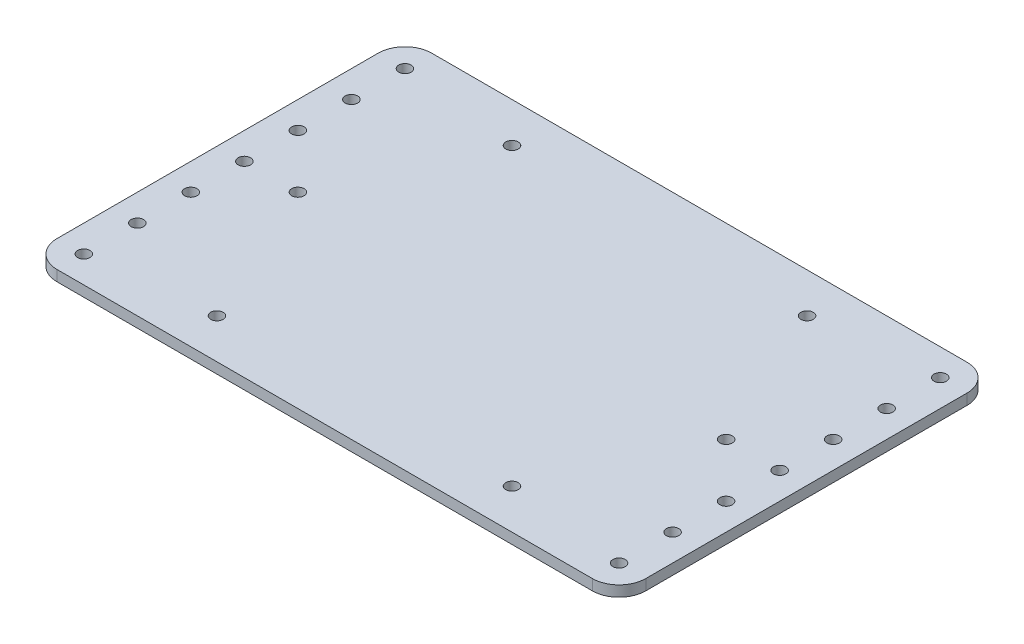
from build123d import *

# Parameters (mm, degrees)
SKETCH1_W           = 139.7
SKETCH1_H           = 88.9
SKETCH1_R           = 1.4732
BOSS_EXTRUDE1_DEPTH = 2.54
FILLET1_R           = 6.35


with BuildPart() as part:
    # Sketch1 → Boss-Extrude1 (new body)
    with BuildSketch(Plane(origin=(0, 0, 0), x_dir=(1, 0, 0), z_dir=(0, 1, 0))):
        with Locations((69.85, -44.45)):
            Rectangle(SKETCH1_W, SKETCH1_H)
        with Locations(Location((34.85, -9.45, 0), (0, 0, 270))):
            Circle(SKETCH1_R, mode=Mode.SUBTRACT)
        with Locations(Location((6.35, -6.35, 0), (0, 0, 270))):
            Circle(SKETCH1_R, mode=Mode.SUBTRACT)
        with Locations(Location((6.35, -19.05, 0), (0, 0, 270))):
            Circle(SKETCH1_R, mode=Mode.SUBTRACT)
        with Locations(Location((6.35, -31.75, 0), (0, 0, 270))):
            Circle(SKETCH1_R, mode=Mode.SUBTRACT)
        with Locations(Location((6.35, -44.45, 0), (0, 0, 270))):
            Circle(SKETCH1_R, mode=Mode.SUBTRACT)
        with Locations(Location((6.35, -57.15, 0), (0, 0, 270))):
            Circle(SKETCH1_R, mode=Mode.SUBTRACT)
        with Locations(Location((6.35, -69.85, 0), (0, 0, 270))):
            Circle(SKETCH1_R, mode=Mode.SUBTRACT)
        with Locations(Location((6.35, -82.55, 0), (0, 0, 270))):
            Circle(SKETCH1_R, mode=Mode.SUBTRACT)
        with Locations(Location((104.85, -9.45, 0), (0, 0, 270))):
            Circle(SKETCH1_R, mode=Mode.SUBTRACT)
        with Locations(Location((104.85, -79.45, 0), (0, 0, 270))):
            Circle(SKETCH1_R, mode=Mode.SUBTRACT)
        with Locations(Location((34.85, -79.45, 0), (0, 0, 270))):
            Circle(SKETCH1_R, mode=Mode.SUBTRACT)
        with Locations(Location((133.35, -82.55, 0), (0, 0, 90))):
            Circle(SKETCH1_R, mode=Mode.SUBTRACT)
        with Locations(Location((133.35, -69.85, 0), (0, 0, 90))):
            Circle(SKETCH1_R, mode=Mode.SUBTRACT)
        with Locations(Location((133.35, -57.15, 0), (0, 0, 90))):
            Circle(SKETCH1_R, mode=Mode.SUBTRACT)
        with Locations(Location((133.35, -44.45, 0), (0, 0, 90))):
            Circle(SKETCH1_R, mode=Mode.SUBTRACT)
        with Locations(Location((133.35, -31.75, 0), (0, 0, 90))):
            Circle(SKETCH1_R, mode=Mode.SUBTRACT)
        with Locations(Location((133.35, -19.05, 0), (0, 0, 90))):
            Circle(SKETCH1_R, mode=Mode.SUBTRACT)
        with Locations(Location((133.35, -6.35, 0), (0, 0, 90))):
            Circle(SKETCH1_R, mode=Mode.SUBTRACT)
        with Locations(Location((19.05, -44.45, 0), (0, 0, 270))):
            Circle(SKETCH1_R, mode=Mode.SUBTRACT)
        with Locations(Location((120.65, -44.45, 0), (0, 0, 270))):
            Circle(SKETCH1_R, mode=Mode.SUBTRACT)
    extrude(amount=BOSS_EXTRUDE1_DEPTH)

    # Fillet1
    fillet1_edges = [part.edges().sort_by_distance(p)[0] for p in [
        (0, 1.27, 0),
        (139.7, 1.27, 0),
        (139.7, 1.27, 88.9),
        (0, 1.27, 88.9),
    ]]
    fillet(fillet1_edges, radius=FILLET1_R)


solid = part.part
